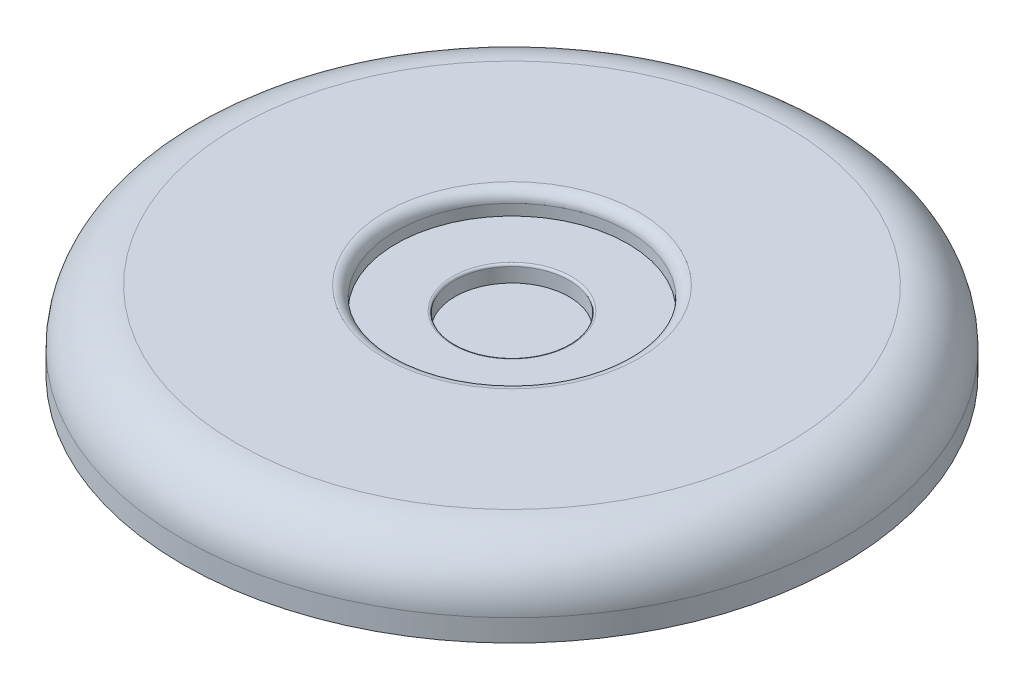
from build123d import *

# Parameters (mm, degrees)
FILLET1_R          = 1
SKETCH2_R          = 5.2
CUT_EXTRUDE1_DEPTH = 1.5
FILLET2_R          = 0.2
FILLET3_R          = 5
CUT_EXTRUDE2_DEPTH = 1


with BuildPart() as part:
    # Sketch1 → Revolve1 (revolve)
    with BuildSketch(Plane(origin=(0, 0, 0), x_dir=(0, 0, -1), z_dir=(1, 0, 0))):
        Polygon((0, 0), (-30, 0), (-30, 7), (-20.102542457, 7), (-10.55, 7), (-10.55, 5), (0, 5), align=None)
    revolve(axis=Axis((0, 5, 0), (0, -1, 0)))

    # Fillet1
    fillet1_edges = [part.edges().sort_by_distance(p)[0] for p in [
        (0, 7, -10.55),
    ]]
    fillet(fillet1_edges, radius=FILLET1_R)

    # Sketch2 → Cut-Extrude1 (cut)
    with BuildSketch(Plane(origin=(0, 5, 0), x_dir=(1, 0, 0), z_dir=(0, 1, 0))):
        with Locations(Location((0, 0, 0), (0, 0, 270))):
            Circle(SKETCH2_R)
    extrude(amount=-CUT_EXTRUDE1_DEPTH, mode=Mode.SUBTRACT)

    # Fillet2
    fillet2_edges = [part.edges().sort_by_distance(p)[0] for p in [
        (0, 5, -5.2),
    ]]
    fillet(fillet2_edges, radius=FILLET2_R)

    # Fillet3
    fillet3_edges = [part.edges().sort_by_distance(p)[0] for p in [
        (0, 7, -30),
    ]]
    fillet(fillet3_edges, radius=FILLET3_R)

    # Sketch4 → Cut-Extrude2 (cut)
    # profile 1 of 4: a face of its own
    with BuildSketch(Plane.XZ):
        Polygon((-0.644909543, 25.480704332), (0.002225874, 25.480704332), (0.002225874, 21.980704332), (-0.31187669, 21.980704332), (-0.31187669, 25.121729973), (-0.850338229, 25.121729973), align=None)
    # profile 2 of 4: a face of its own
    with BuildSketch(Plane.XZ):
        with BuildLine():
            Line((25.523815675, 2.292498481), (25.209713111, 2.292498481))
            add(Edge.make_bspline(
                [(25.209713111, 2.292498481), (25.211760264, 2.334169369), (25.215780818, 2.416009884), (25.234609107, 2.53533379), (25.261549984, 2.649388589), (25.299641438, 2.757258503), (25.346947716, 2.85989731), (25.403677743, 2.956897326), (25.470871594, 3.047888515), (25.547078328, 3.132027358), (25.629846967, 3.209214929), (25.719152906, 3.275870171), (25.812997934, 3.332187843), (25.911097333, 3.379269085), (26.014557896, 3.414608931), (26.122440754, 3.44083057), (26.23521989, 3.456606916), (26.312059912, 3.458302702), (26.351139393, 3.459165148)],
                knots=[0, 0, 0, 0, 1.10065271, 2.161652631, 3.183658789, 4.190468796, 5.17591951, 6.163126047, 7.15150782, 8.156236427, 9.156009102, 10.134482811, 11.092018607, 12.041330605, 13.001268258, 13.972401359, 14.968799086, 16, 16, 16, 16], degree=3))
            add(Edge.make_bspline(
                [(26.351139393, 3.459165148), (26.389517467, 3.458266692), (26.464929011, 3.456501257), (26.574991026, 3.441340228), (26.67976832, 3.417594636), (26.779056087, 3.38427922), (26.872062151, 3.339494792), (26.959485196, 3.285697254), (27.042366007, 3.223477422), (27.11697279, 3.150223609), (27.18548087, 3.072021224), (27.244583125, 2.988533321), (27.295196288, 2.902304035), (27.337383968, 2.812675833), (27.368440107, 2.718804805), (27.392018315, 2.622057602), (27.405345729, 2.521432791), (27.407391152, 2.453326236), (27.408431059, 2.418700405)],
                knots=[0, 0, 0, 0, 1.111607364, 2.184268762, 3.212621178, 4.221274766, 5.211760367, 6.196651075, 7.1921475, 8.207485113, 9.220403448, 10.201281604, 11.166441695, 12.114753415, 13.065576456, 14.026450734, 14.996634279, 16, 16, 16, 16], degree=3))
            add(Edge.make_bspline(
                [(27.408431059, 2.418700405), (27.406744414, 2.369950595), (27.403400723, 2.273306467), (27.37454502, 2.13110211), (27.329962923, 1.99319705), (27.275889894, 1.882217998), (27.221269326, 1.793241105), (27.17308953, 1.719325464), (27.115437178, 1.640499047), (27.048839764, 1.555967938), (26.974301958, 1.465473568), (26.89128729, 1.368978802), (26.7991616, 1.267508497), (26.734503418, 1.198202684), (26.700999168, 1.162290148)],
                knots=[0, 0, 0, 0, 1.184203166, 2.347625244, 3.513805382, 4.700623107, 5.337941753, 6.051866363, 6.845199593, 7.711357327, 8.668078039, 9.695487809, 10.805859518, 12, 12, 12, 12], degree=3))
            Line((26.700999168, 1.162290148), (25.825298046, 0.228395917))
            Line((25.825298046, 0.228395917), (27.453302854, 0.228395917))
            Line((27.453302854, 0.228395917), (27.453302854, -0.130578442))
            Line((27.453302854, -0.130578442), (25.075097726, -0.130578442))
            Line((25.075097726, -0.130578442), (26.432469521, 1.317939187))
            add(Edge.make_bspline(
                [(26.432469521, 1.317939187), (26.465517408, 1.352437493), (26.528995635, 1.41870168), (26.618778212, 1.51544464), (26.6994172, 1.605194181), (26.771434593, 1.687780729), (26.833268098, 1.764412297), (26.88814033, 1.832607), (26.932105921, 1.895361451), (26.979821317, 1.968102065), (27.026035298, 2.056914382), (27.065747654, 2.165448071), (27.089962502, 2.277175324), (27.092867338, 2.352677361), (27.094328495, 2.390655533)],
                knots=[0, 0, 0, 0, 1.329631726, 2.553950428, 3.673215718, 4.687767853, 5.603093632, 6.413772471, 7.123043292, 7.734684054, 8.834405432, 9.900288307, 10.943827018, 12, 12, 12, 12], degree=3))
            add(Edge.make_bspline(
                [(27.094328495, 2.390655533), (27.093692753, 2.414536931), (27.092439827, 2.461602582), (27.081382129, 2.530608341), (27.064671623, 2.597173154), (27.040726365, 2.661501774), (27.009119625, 2.722947426), (26.970646245, 2.781584906), (26.926256182, 2.838273871), (26.874904912, 2.891427169), (26.818493393, 2.940108375), (26.758899143, 2.98323246), (26.695849039, 3.019271571), (26.629608917, 3.048815068), (26.560363447, 3.071990449), (26.487978702, 3.088049029), (26.412654686, 3.098131512), (26.36122119, 3.099495684), (26.335013591, 3.100190789)],
                knots=[0, 0, 0, 0, 0.991446411, 1.95395049, 2.89581595, 3.838931463, 4.798493298, 5.75982156, 6.748411868, 7.785213223, 8.824556874, 9.840280684, 10.836137867, 11.835679398, 12.848801643, 13.863922112, 14.911575587, 16, 16, 16, 16], degree=3))
            add(Edge.make_bspline(
                [(26.335013591, 3.100190789), (26.307642759, 3.099475757), (26.253890962, 3.098071552), (26.174971929, 3.088248888), (26.099686152, 3.071303047), (26.027844249, 3.048126373), (25.959324663, 3.018667824), (25.894460619, 2.981976079), (25.83339773, 2.938192586), (25.776021206, 2.88855203), (25.723157227, 2.833284429), (25.676710352, 2.771674466), (25.636126337, 2.70484705), (25.600717104, 2.6329825), (25.571961414, 2.55542872), (25.549988263, 2.472461015), (25.532601417, 2.384439633), (25.526792896, 2.323654549), (25.523815675, 2.292498481)],
                knots=[0, 0, 0, 0, 1.031018746, 2.02475058, 2.990194455, 3.934040569, 4.864654155, 5.795059489, 6.735614925, 7.690564532, 8.649604399, 9.611025574, 10.590972636, 11.591080095, 12.624614302, 13.701020113, 14.821632451, 16, 16, 16, 16], degree=3))
        make_face()
    # profile 3 of 4: a face of its own
    with BuildSketch(Plane.XZ):
        with BuildLine():
            Line((0.191598009, -25.382057247), (-0.122504556, -25.382057247))
            add(Edge.make_bspline(
                [(-0.122504556, -25.382057247), (-0.113995005, -25.346824763), (-0.097359529, -25.277948138), (-0.062661956, -25.179540878), (-0.024862701, -25.086417356), (0.020526404, -25.000321283), (0.070035158, -24.91952238), (0.12675788, -24.845853255), (0.188077602, -24.77744029), (0.255902552, -24.716727052), (0.327031213, -24.661749323), (0.402465833, -24.614874266), (0.480688727, -24.574550113), (0.56224186, -24.541329881), (0.647368031, -24.516304357), (0.735297655, -24.498147552), (0.826261155, -24.486356438), (0.888008745, -24.485205674), (0.919362432, -24.484621349)],
                knots=[0, 0, 0, 0, 1.162005537, 2.271625781, 3.343758855, 4.383309926, 5.390229558, 6.379919256, 7.361854164, 8.333198761, 9.295911338, 10.242430842, 11.177959212, 12.116337295, 13.062827104, 14.020064771, 14.994644689, 16, 16, 16, 16], degree=3))
            add(Edge.make_bspline(
                [(0.919362432, -24.484621349), (0.965045174, -24.48600058), (1.055414185, -24.488728955), (1.188177232, -24.513643392), (1.316204051, -24.553068524), (1.438093299, -24.607542251), (1.551311731, -24.674729564), (1.652047918, -24.754694301), (1.738936429, -24.845893603), (1.811830806, -24.946626167), (1.868905805, -25.054281676), (1.910992179, -25.165081833), (1.93661386, -25.278763805), (1.939934417, -25.355521084), (1.941598009, -25.393976317)],
                knots=[0, 0, 0, 0, 1.083050992, 2.142477498, 3.193116406, 4.255571735, 5.30263384, 6.308962982, 7.297363603, 8.282367274, 9.249857812, 10.179914175, 11.08814088, 12, 12, 12, 12], degree=3))
            add(Edge.make_bspline(
                [(1.941598009, -25.393976317), (1.940434418, -25.430983112), (1.93815745, -25.503399667), (1.918823745, -25.609121164), (1.886287482, -25.708762764), (1.841217719, -25.802743926), (1.782876169, -25.890468766), (1.712203472, -25.972134657), (1.628700811, -26.048103815), (1.565421872, -26.091623288), (1.532844002, -26.114028401)],
                knots=[0, 0, 0, 0, 1.024540389, 2.004866551, 2.965041327, 3.920577974, 4.882998113, 5.874504559, 6.905732034, 8, 8, 8, 8], degree=3))
            add(Edge.make_bspline(
                [(1.532844002, -26.114028401), (1.570075757, -26.132006572), (1.643842631, -26.16762653), (1.744393161, -26.237482287), (1.835671036, -26.318138635), (1.886574755, -26.381081288), (1.912150893, -26.412706285)],
                knots=[0, 0, 0, 0, 1.015518401, 2.012035669, 3.001164323, 4, 4, 4, 4], degree=3))
            add(Edge.make_bspline(
                [(1.912150893, -26.412706285), (1.928992236, -26.435764037), (1.962399132, -26.481501953), (2.003634665, -26.555038379), (2.04104378, -26.629389869), (2.070193999, -26.706549275), (2.092767866, -26.785622288), (2.108903898, -26.866744684), (2.118928039, -26.949982707), (2.120363591, -27.006295187), (2.121085188, -27.034601317)],
                knots=[0, 0, 0, 0, 1.025084078, 2.033381695, 3.024893161, 4.013698104, 4.991890475, 5.976764909, 6.982997093, 8, 8, 8, 8], degree=3))
            add(Edge.make_bspline(
                [(2.121085188, -27.034601317), (2.119290675, -27.083611039), (2.115710093, -27.18139984), (2.083706018, -27.325874562), (2.034092778, -27.467100064), (1.963635842, -27.602174904), (1.877768333, -27.728555285), (1.775611009, -27.841631594), (1.6583246, -27.938830198), (1.527518951, -28.020040426), (1.385801823, -28.084958348), (1.234226231, -28.130015791), (1.074976177, -28.159361791), (0.965768879, -28.16250866), (0.910247848, -28.164108529)],
                knots=[0, 0, 0, 0, 0.955779014, 1.907060117, 2.875433937, 3.871313158, 4.872415639, 5.851225146, 6.836215519, 7.83643374, 8.849228613, 9.86973379, 10.916971861, 12, 12, 12, 12], degree=3))
            add(Edge.make_bspline(
                [(0.910247848, -28.164108529), (0.872828548, -28.163240316), (0.799199843, -28.161531961), (0.690956345, -28.14985336), (0.587634645, -28.128523355), (0.489095047, -28.09982005), (0.395250011, -28.063428308), (0.306385906, -28.01810961), (0.221956012, -27.964798108), (0.142757061, -27.90286452), (0.068798493, -27.83358318), (0.002045769, -27.75572417), (-0.058614024, -27.670726766), (-0.111556662, -27.57760371), (-0.159193615, -27.477558453), (-0.198374572, -27.369309954), (-0.23286014, -27.253825932), (-0.248893605, -27.173348192), (-0.25711994, -27.132057247)],
                knots=[0, 0, 0, 0, 1.048658725, 2.063410685, 3.046034179, 4.001477787, 4.936774919, 5.862367409, 6.792675028, 7.730719943, 8.675894397, 9.627829632, 10.600096036, 11.597688215, 12.626045268, 13.701542398, 14.82072376, 16, 16, 16, 16], degree=3))
            Line((-0.25711994, -27.132057247), (0.056982624, -27.132057247))
            add(Edge.make_bspline(
                [(0.056982624, -27.132057247), (0.065165915, -27.15900626), (0.081083128, -27.211424432), (0.108177426, -27.286864737), (0.139045698, -27.356022791), (0.172160257, -27.419405913), (0.206938703, -27.477638315), (0.245853628, -27.529180184), (0.286022773, -27.576295386), (0.316302126, -27.602839998), (0.331121246, -27.615831285)],
                knots=[0, 0, 0, 0, 1.198163088, 2.33053128, 3.407730985, 4.417276592, 5.372219308, 6.28897303, 7.162600585, 8, 8, 8, 8], degree=3))
            add(Edge.make_bspline(
                [(0.331121246, -27.615831285), (0.350717822, -27.630939619), (0.389850485, -27.661109651), (0.453618716, -27.69961128), (0.520683602, -27.732972305), (0.592498277, -27.758456001), (0.667513047, -27.780033661), (0.746940412, -27.79415418), (0.830079629, -27.803842352), (0.886847393, -27.804697283), (0.915856823, -27.80513417)],
                knots=[0, 0, 0, 0, 0.946170439, 1.889420265, 2.845303464, 3.807233317, 4.801018734, 5.828864929, 6.890507805, 8, 8, 8, 8], degree=3))
            add(Edge.make_bspline(
                [(0.915856823, -27.80513417), (0.948610325, -27.804518265), (1.012656972, -27.803313915), (1.106111832, -27.792238208), (1.195019279, -27.776107795), (1.278392205, -27.751194812), (1.357322712, -27.720413961), (1.430704362, -27.681765555), (1.499500468, -27.636420833), (1.562829874, -27.584881675), (1.619775381, -27.52846018), (1.669914894, -27.469447109), (1.712539556, -27.408091279), (1.746923134, -27.344053158), (1.774073684, -27.277597929), (1.792556885, -27.2085391), (1.8054084, -27.137441834), (1.806455012, -27.089112865), (1.806982624, -27.064749555)],
                knots=[0, 0, 0, 0, 1.217147791, 2.380027433, 3.494444702, 4.572153297, 5.609568379, 6.639424714, 7.649109417, 8.668170816, 9.669597737, 10.625200337, 11.543417969, 12.441394052, 13.322311151, 14.205496177, 15.095365482, 16, 16, 16, 16], degree=3))
            add(Edge.make_bspline(
                [(1.806982624, -27.064749555), (1.805452322, -27.032138216), (1.802399334, -26.967077807), (1.779090755, -26.871360233), (1.74075189, -26.779136821), (1.687079379, -26.691981031), (1.62174365, -26.611205129), (1.545378744, -26.539133647), (1.457350515, -26.479663556), (1.376330646, -26.438574899), (1.30456549, -26.410537824), (1.243150105, -26.39186286), (1.174393502, -26.376049204), (1.099127153, -26.361336932), (1.016783936, -26.348815584), (0.927453498, -26.338373768), (0.831117737, -26.330018727), (0.764426571, -26.326287632), (0.730059547, -26.324364939)],
                knots=[0, 0, 0, 0, 1.07054697, 2.135767047, 3.216561865, 4.33974944, 5.486079747, 6.621378074, 7.775625952, 8.963672916, 9.598146892, 10.304877434, 11.070270905, 11.915000392, 12.823868403, 13.805723172, 14.86925407, 16, 16, 16, 16], degree=3))
            Line((0.730059547, -26.324364939), (0.730059547, -25.96539058))
            add(Edge.make_bspline(
                [(0.730059547, -25.96539058), (0.773360713, -25.964655776), (0.858177059, -25.963216476), (0.982071364, -25.945808466), (1.100544676, -25.921727838), (1.210971418, -25.884842646), (1.311620132, -25.842002349), (1.398939734, -25.792150139), (1.471706881, -25.73673539), (1.529567952, -25.674902781), (1.573097181, -25.608587733), (1.604923979, -25.539471076), (1.623724305, -25.466947015), (1.626233972, -25.417452347), (1.627495444, -25.392574074)],
                knots=[0, 0, 0, 0, 1.321986639, 2.589447074, 3.816329219, 5.01088745, 6.139805852, 7.153945165, 8.075214402, 8.924034688, 9.728124013, 10.488707548, 11.240355623, 12, 12, 12, 12], degree=3))
            add(Edge.make_bspline(
                [(1.627495444, -25.392574074), (1.627081034, -25.374296329), (1.626256583, -25.337933622), (1.615859305, -25.284808553), (1.600235264, -25.233307607), (1.578755535, -25.183649797), (1.550005336, -25.136179523), (1.515599349, -25.090492074), (1.474631249, -25.046848295), (1.427685802, -25.006167975), (1.377273997, -24.967398738), (1.322024222, -24.934485101), (1.263602347, -24.906340039), (1.201943692, -24.883130537), (1.136848162, -24.865671249), (1.068621604, -24.853135407), (0.997133921, -24.845297753), (0.948362189, -24.844169337), (0.923569162, -24.843595708)],
                knots=[0, 0, 0, 0, 0.884392785, 1.759457502, 2.611959086, 3.489218968, 4.37281399, 5.2945488, 6.255912374, 7.266815255, 8.301784654, 9.332968512, 10.37626691, 11.440494194, 12.520033166, 13.637162961, 14.798855837, 16, 16, 16, 16], degree=3))
            add(Edge.make_bspline(
                [(0.923569162, -24.843595708), (0.883717494, -24.84498707), (0.805877918, -24.847704724), (0.693663001, -24.871507737), (0.589343667, -24.909485821), (0.509605001, -24.95481884), (0.450722426, -24.999569274), (0.408645488, -25.038651661), (0.367324978, -25.082084484), (0.329479301, -25.13254286), (0.291205324, -25.18660965), (0.256360763, -25.247033331), (0.22250107, -25.312237726), (0.202098521, -25.35833336), (0.191598009, -25.382057247)],
                knots=[0, 0, 0, 0, 1.472543308, 2.876219568, 4.221790263, 5.565193594, 6.249813518, 6.953379497, 7.687249741, 8.463570142, 9.283606569, 10.136032583, 11.040678096, 12, 12, 12, 12], degree=3))
        make_face()
    # profile 4 of 4: a face of its own
    with BuildSketch(Plane.XZ):
        Polygon((-24.810460542, 5.722524802), (-24.746658459, 5.722524802), (-24.746658459, 3.299447879), (-24.342812305, 3.299447879), (-24.342812305, 2.94047352), (-24.746658459, 2.94047352), (-24.746658459, 2.132781212), (-25.060761023, 2.132781212), (-25.060761023, 2.94047352), (-26.721017433, 2.94047352), align=None)
        Polygon((-25.060761023, 3.299447879), (-25.060761023, 4.818077687), (-26.103329132, 3.299447879), align=None, mode=Mode.SUBTRACT)
    extrude(amount=-CUT_EXTRUDE2_DEPTH, mode=Mode.SUBTRACT)


solid = part.part
